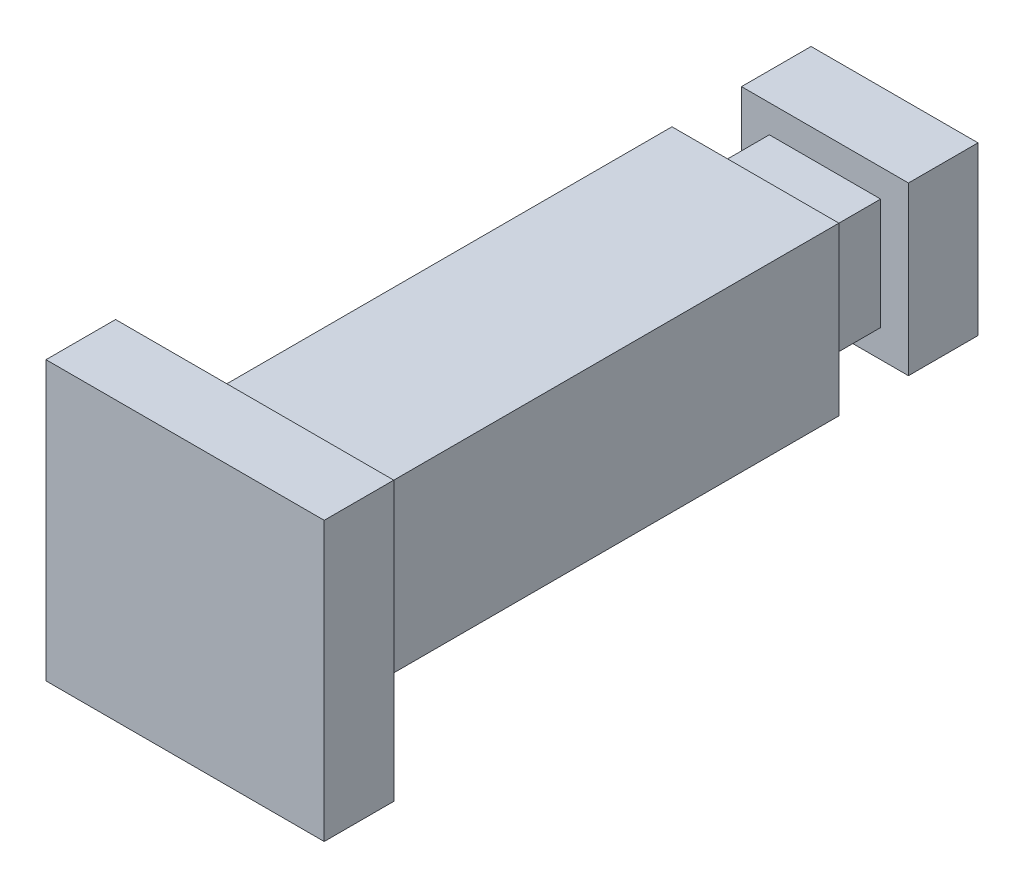
from build123d import *

# Parameters (mm, degrees)
SKETCH1_W           = 6
SKETCH1_H           = 6
BOSS_EXTRUDE1_DEPTH = 18
SKETCH2_W           = 10
SKETCH2_H           = 10
BOSS_EXTRUDE2_DEPTH = 2.5
SKETCH5_W           = 4
SKETCH5_H           = 4
BOSS_EXTRUDE4_DEPTH = 2.5
SKETCH6_W           = 6
SKETCH6_H           = 6
BOSS_EXTRUDE5_DEPTH = 2.5


with BuildPart() as part:
    # Sketch1 → Boss-Extrude1 (new body)
    with BuildSketch(Plane.XY):
        with Locations((3, 3)):
            Rectangle(SKETCH1_W, SKETCH1_H)
    extrude(amount=BOSS_EXTRUDE1_DEPTH)

    # Sketch2 → Boss-Extrude2 (add)
    with BuildSketch(Plane.XY.offset(18)):
        with Locations((3, 3)):
            Rectangle(SKETCH2_W, SKETCH2_H)
    extrude(amount=BOSS_EXTRUDE2_DEPTH)

    # Sketch5 → Boss-Extrude4 (add)
    with BuildSketch(Plane(origin=(0, 0, 0), x_dir=(-1, 0, 0), z_dir=(0, 0, -1))):
        with Locations((-3, 3)):
            Rectangle(SKETCH5_W, SKETCH5_H)
    extrude(amount=BOSS_EXTRUDE4_DEPTH)

    # Sketch6 → Boss-Extrude5 (add)
    with BuildSketch(Plane(origin=(0, 0, -2.5), x_dir=(-1, 0, 0), z_dir=(0, 0, -1))):
        with Locations((-3, 3)):
            Rectangle(SKETCH6_W, SKETCH6_H)
    extrude(amount=BOSS_EXTRUDE5_DEPTH)


solid = part.part
